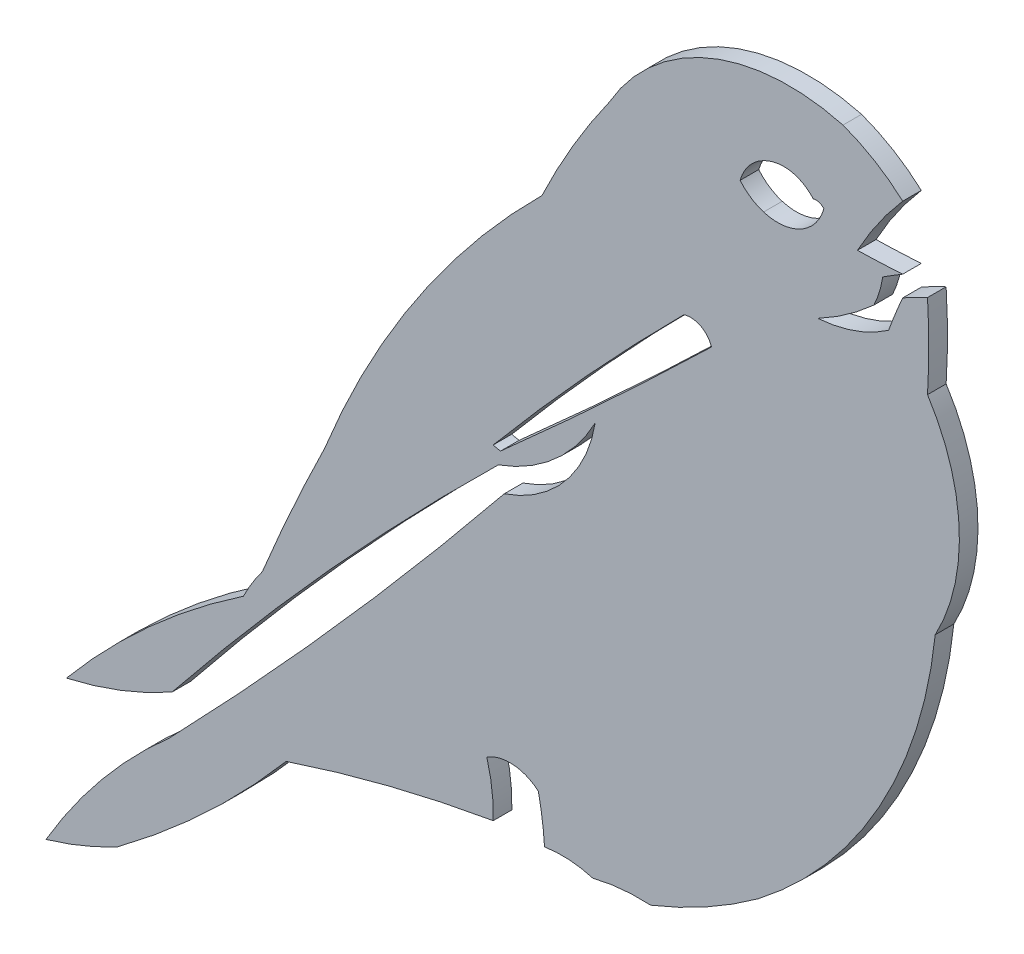
from build123d import *

# Parameters (mm, degrees)
EXTRUDE_1_DEPTH = 0.6


with BuildPart() as part:
    # 스케치1 → 보스-돌출1 (new body)
    with BuildSketch(Plane.XY):
        with BuildLine():
            ThreePointArc((4.243865228, 6.118140931), (3.92164821, 5.921191263), (3.601804057, 5.720411047))
            ThreePointArc((3.601804057, 5.720411047), (3.493384012, 5.24542324), (3.316336948, 4.791526049))
            ThreePointArc((3.316336948, 4.791526049), (2.452686661, 4.097818684), (1.509336268, 3.517119312))
            ThreePointArc((1.509336268, 3.517119312), (2.704109532, 3.767922564), (3.790546418, 4.324735205))
            ThreePointArc((3.790546418, 4.324735205), (4.007319334, 4.893950514), (4.243865228, 5.455237077))
            ThreePointArc((4.243865228, 5.455237077), (4.639299082, 5.669042259), (5.043553271, 5.865661533))
            ThreePointArc((5.043553271, 5.865661533), (5.086534646, 4.510854203), (5.043553271, 3.156046874))
            ThreePointArc((5.043553271, 3.156046874), (6.065944614, -0.097812915), (5.291753627, -3.419486575))
            ThreePointArc((5.291753627, -3.419486575), (3.490836657, -9.120276828), (-0.418085028, -13.643842092))
            ThreePointArc((-0.418085028, -13.643842092), (-2.087490816, -14.704669315), (-3.875685356, -15.550027444))
            ThreePointArc((-3.875685356, -15.550027444), (-4.814989199, -15.5684183), (-5.740747963, -15.728420312))
            ThreePointArc((-5.740747963, -15.728420312), (-6.513490531, -15.594064313), (-7.296832392, -15.633537604))
            ThreePointArc((-7.296832392, -15.633537604), (-7.368791385, -14.902567754), (-7.494700457, -14.178936686))
            ThreePointArc((-7.494700457, -14.178936686), (-8.304954519, -13.843397992), (-9.155598119, -14.056713079))
            ThreePointArc((-9.155598119, -14.056713079), (-8.9873833, -14.884534295), (-8.949428325, -15.728420312))
            ThreePointArc((-8.949428325, -15.728420312), (-12.316982906, -16.443277918), (-15.620992713, -17.410213517))
            ThreePointArc((-15.620992713, -17.410213517), (-18.192390504, -20.114679115), (-21.053078027, -22.511069665))
            ThreePointArc((-21.053078027, -22.511069665), (-22.181356159, -23.04421905), (-23.359176817, -23.456527561))
            ThreePointArc((-23.359176817, -23.456527561), (-21.55820937, -20.881039072), (-19.369361534, -18.625918265))
            ThreePointArc((-19.369361534, -18.625918265), (-13.849484699, -12.644014904), (-8.593743971, -6.428759681))
            ThreePointArc((-8.593743971, -6.428759681), (-6.650317937, -5.116178912), (-5.664079914, -2.988478841))
            ThreePointArc((-5.664079914, -2.988478841), (-6.968956966, -4.648017071), (-8.787254134, -5.720661777))
            ThreePointArc((-8.787254134, -5.720661777), (-14.217270083, -11.359132573), (-19.298032623, -17.314237787))
            ThreePointArc((-19.298032623, -17.314237787), (-20.952003277, -18.09423566), (-22.701668736, -18.625918265))
            ThreePointArc((-22.701668736, -18.625918265), (-20.032240522, -15.856920342), (-16.99977962, -13.491042629))
            ThreePointArc((-16.99977962, -13.491042629), (-16.716409139, -12.979319841), (-16.386941379, -12.49598762))
            ThreePointArc((-16.386941379, -12.49598762), (-15.418772116, -10.250862917), (-14.374813618, -8.039960994))
            ThreePointArc((-14.374813618, -8.039960994), (-11.420678404, -2.410213973), (-7.380723905, 2.498934021))
            ThreePointArc((-7.380723905, 2.498934021), (-6.377004033, 4.393223264), (-5.210202068, 6.191655495))
            ThreePointArc((-5.210202068, 6.191655495), (-1.978219396, 9.037163181), (2.318833307, 9.316383632))
            ThreePointArc((2.318833307, 9.316383632), (3.338100738, 8.829609856), (4.243865228, 8.154742835))
            ThreePointArc((4.243865228, 8.154742835), (3.456899221, 7.145606029), (2.786183745, 6.055737532))
            ThreePointArc((2.786183745, 6.055737532), (3.51538621, 6.078489728), (4.243865228, 6.118140931))
        make_face()
        with BuildLine():
            ThreePointArc((-2.808227805, 1.460594831), (-5.951081989, -1.825237175), (-8.949428325, -5.243444841))
            ThreePointArc((-8.949428325, -5.243444841), (-8.831818054, -5.27564433), (-8.711437416, -5.295073305))
            ThreePointArc((-8.711437416, -5.295073305), (-5.278864783, -2.182820323), (-1.91601492, 1.004641725))
            ThreePointArc((-1.91601492, 1.004641725), (-2.267690382, 1.417401617), (-2.808227805, 1.460594831))
        make_face(mode=Mode.SUBTRACT)
        with BuildLine():
            ThreePointArc((-0.993904208, 6.118140931), (-0.547936142, 6.833647448), (0.215079605, 7.192317298))
            ThreePointArc((0.215079605, 7.192317298), (0.841318807, 7.133240086), (1.361301437, 6.779285683))
            ThreePointArc((1.361301437, 6.779285683), (1.548522148, 6.776978051), (1.702780334, 6.670858627))
            ThreePointArc((1.702780334, 6.670858627), (0.955764837, 5.731971759), (-0.237955168, 5.611252025))
            ThreePointArc((-0.237955168, 5.611252025), (-0.653261747, 5.809021292), (-0.993904208, 6.118140931))
        make_face(mode=Mode.SUBTRACT)
    extrude(amount=EXTRUDE_1_DEPTH)


solid = part.part
